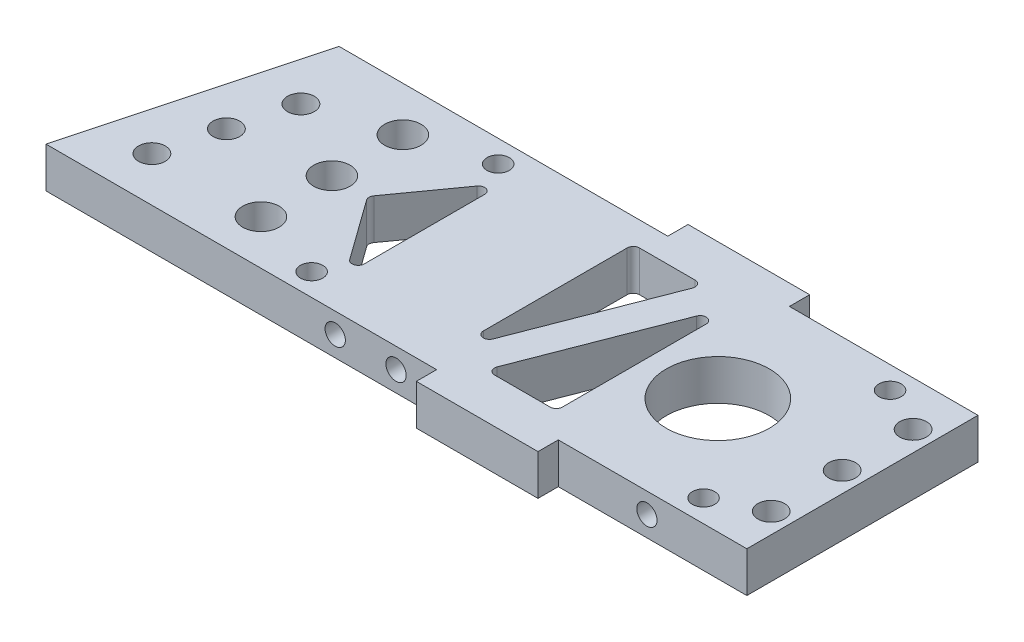
from build123d import *

# Parameters (mm, degrees)
RESSALTO_EXTRUS_O1_DEPTH                    = 10
FURO_COM_FOLGA_DE_M61_D                     = 6.6
FURO_COM_FOLGA_DE_M61_DEPTH                 = 15
FURO_COM_FOLGA_DE_M61_TIP                   = 1.982840043
ESBO_O5_R                                   = 9.525
CORTE_EXTRUS_O1_DEPTH                       = 184.877003456
ESBO_O6_R                                   = 12.7
CORTE_EXTRUS_O2_DEPTH                       = 184.877003456
BROCA_DE_ROSQUEAR_PARA_TARRAXA_DE_M61_D     = 5
BROCA_DE_ROSQUEAR_PARA_TARRAXA_DE_M61_DEPTH = 15
BROCA_DE_ROSQUEAR_PARA_TARRAXA_DE_M61_TIP   = 1.502151548
BROCA_DE_ROSQUEAR_PARA_TARRAXA_DE_M62_D     = 5
BROCA_DE_ROSQUEAR_PARA_TARRAXA_DE_M62_DEPTH = 15
BROCA_DE_ROSQUEAR_PARA_TARRAXA_DE_M62_TIP   = 1.502151548
FURO_COM_FOLGA_DE_M81_D                     = 9
FURO_COM_FOLGA_DE_M51_D                     = 5.5
FURO_COM_FOLGA_DE_M51_DEPTH                 = 15
FURO_COM_FOLGA_DE_M51_TIP                   = 1.652366702
CORTE_EXTRUS_O5_DEPTH                       = 184.877003456
FURO_COM_FOLGA_DE_M62_D                     = 6.6
CORTE_EXTRUS_O6_DEPTH                       = 184.877003456
FILETE3_R                                   = 1.5


with BuildPart() as part:
    # Esboço2 → Ressalto-extrusão1 (new body)
    with BuildSketch(Plane(origin=(0, 0, 0), x_dir=(1, 0, 0), z_dir=(0, 1, 0))):
        Polygon((0, 0), (96.32, 0), (96.32, -5), (126.32, -5), (126.32, 0), (172.82, 0), (172.82, 57), (126.32, 57), (126.32, 62), (96.32, 62), (96.32, 57), (0, 57), align=None)
    extrude(amount=RESSALTO_EXTRUS_O1_DEPTH)

    # Furo com folga de M61
    with Locations(Plane(origin=(0, 10, 0), x_dir=(1, 0, 0), z_dir=(0, 1, 0))):
        with Locations((167.82, 46), (167.82, 28.5), (167.82, 11)):
            Hole(FURO_COM_FOLGA_DE_M61_D / 2, depth=FURO_COM_FOLGA_DE_M61_DEPTH)
            with Locations((0, 0, -(FURO_COM_FOLGA_DE_M61_DEPTH + FURO_COM_FOLGA_DE_M61_TIP / 2))):  # 118° drill point
                Cone(0, FURO_COM_FOLGA_DE_M61_D / 2, FURO_COM_FOLGA_DE_M61_TIP, mode=Mode.SUBTRACT)

    # Esboço5 → Corte-extrusão1 (cut, through all)
    with BuildSketch(Plane(origin=(0, 10, 0), x_dir=(1, 0, 0), z_dir=(0, 1, 0))):
        with Locations(Location((137.17, 28.5, 0), (0, 0, 270))):
            Circle(ESBO_O5_R)
    extrude(amount=-CORTE_EXTRUS_O1_DEPTH, mode=Mode.SUBTRACT)

    # Esboço6 → Corte-extrusão2 (cut, through all)
    with BuildSketch(Plane(origin=(0, 10, 0), x_dir=(1, 0, 0), z_dir=(0, 1, 0))):
        with Locations(Location((137.17, 28.5, 0), (0, 0, 270))):
            Circle(ESBO_O6_R)
    extrude(amount=-CORTE_EXTRUS_O2_DEPTH, mode=Mode.SUBTRACT)

    # Broca de rosquear para tarraxa de M61
    with Locations(Plane(origin=(0, 0, -57), x_dir=(-1, 0, 0), z_dir=(0, 0, -1))):
        with Locations((-148.17, 5), (-86.32, 5), (-71.32, 5)):
            Hole(BROCA_DE_ROSQUEAR_PARA_TARRAXA_DE_M61_D / 2, depth=BROCA_DE_ROSQUEAR_PARA_TARRAXA_DE_M61_DEPTH)
            with Locations((0, 0, -(BROCA_DE_ROSQUEAR_PARA_TARRAXA_DE_M61_DEPTH + BROCA_DE_ROSQUEAR_PARA_TARRAXA_DE_M61_TIP / 2))):  # 118° drill point
                Cone(0, BROCA_DE_ROSQUEAR_PARA_TARRAXA_DE_M61_D / 2, BROCA_DE_ROSQUEAR_PARA_TARRAXA_DE_M61_TIP, mode=Mode.SUBTRACT)

    # Broca de rosquear para tarraxa de M62
    with Locations(Plane.XY):
        with Locations((86.32, 5), (148.17, 5), (71.32, 5)):
            Hole(BROCA_DE_ROSQUEAR_PARA_TARRAXA_DE_M62_D / 2, depth=BROCA_DE_ROSQUEAR_PARA_TARRAXA_DE_M62_DEPTH)
            with Locations((0, 0, -(BROCA_DE_ROSQUEAR_PARA_TARRAXA_DE_M62_DEPTH + BROCA_DE_ROSQUEAR_PARA_TARRAXA_DE_M62_TIP / 2))):  # 118° drill point
                Cone(0, BROCA_DE_ROSQUEAR_PARA_TARRAXA_DE_M62_D / 2, BROCA_DE_ROSQUEAR_PARA_TARRAXA_DE_M62_TIP, mode=Mode.SUBTRACT)

    # Furo com folga de M81 (through all)
    with Locations(Plane(origin=(0, 10, 0), x_dir=(1, 0, 0), z_dir=(0, 1, 0))):
        with Locations((42, 46), (42, 28.5), (42, 11)):
            Hole(FURO_COM_FOLGA_DE_M81_D / 2)

    # Furo com folga de M51
    with Locations(Plane(origin=(0, 10, 0), x_dir=(1, 0, 0), z_dir=(0, 1, 0))):
        with Locations((156.64, 51.5), (156.64, 5.5), (60, 5.5), (60, 51.5)):
            Hole(FURO_COM_FOLGA_DE_M51_D / 2, depth=FURO_COM_FOLGA_DE_M51_DEPTH)
            with Locations((0, 0, -(FURO_COM_FOLGA_DE_M51_DEPTH + FURO_COM_FOLGA_DE_M51_TIP / 2))):  # 118° drill point
                Cone(0, FURO_COM_FOLGA_DE_M51_D / 2, FURO_COM_FOLGA_DE_M51_TIP, mode=Mode.SUBTRACT)

    # Esboço22 → Corte-extrusão5 (cut, through all)
    with BuildSketch(Plane(origin=(0, 10, 0), x_dir=(1, 0, 0), z_dir=(0, 1, 0))):
        Polygon((0, 0), (0, 57), (15.273103969, 57), align=None)
    extrude(amount=-CORTE_EXTRUS_O5_DEPTH, mode=Mode.SUBTRACT)

    # Furo com folga de M62 (through all)
    with Locations(Plane(origin=(0, 0, 0), x_dir=(-1, 0, 0), z_dir=(0, -1, 0))):
        with Locations((-22.851404532, 40), (-15.086833179, 11.022225211), (-18.969118855, 25.511112606)):
            Hole(FURO_COM_FOLGA_DE_M62_D / 2)

    # Esboço25 → Corte-extrusão6 (cut, through all)
    with BuildSketch(Plane(origin=(0, 10, 0), x_dir=(1, 0, 0), z_dir=(0, 1, 0))):
        Polygon((64.82, 9), (50.82, 28.5), (64.82, 48), align=None)
        Polygon((93.82, 51), (111.241406328, 51), (93.82, 6), align=None)
        Polygon((102.398593672, 6), (119.82, 51), (119.82, 6), align=None)
    extrude(amount=-CORTE_EXTRUS_O6_DEPTH, mode=Mode.SUBTRACT)

    # Filete3
    filete3_edges = [part.edges().sort_by_distance(p)[0] for p in [
        (64.82, 5, -48),
        (64.82, 5, -9),
        (50.82, 5, -28.5),
        (119.82, 5, -6),
        (102.398593672, 5, -6),
        (119.82, 5, -51),
        (93.82, 5, -6),
        (93.82, 5, -51),
        (111.241406328, 5, -51),
    ]]
    fillet(filete3_edges, radius=FILETE3_R)


solid = part.part
